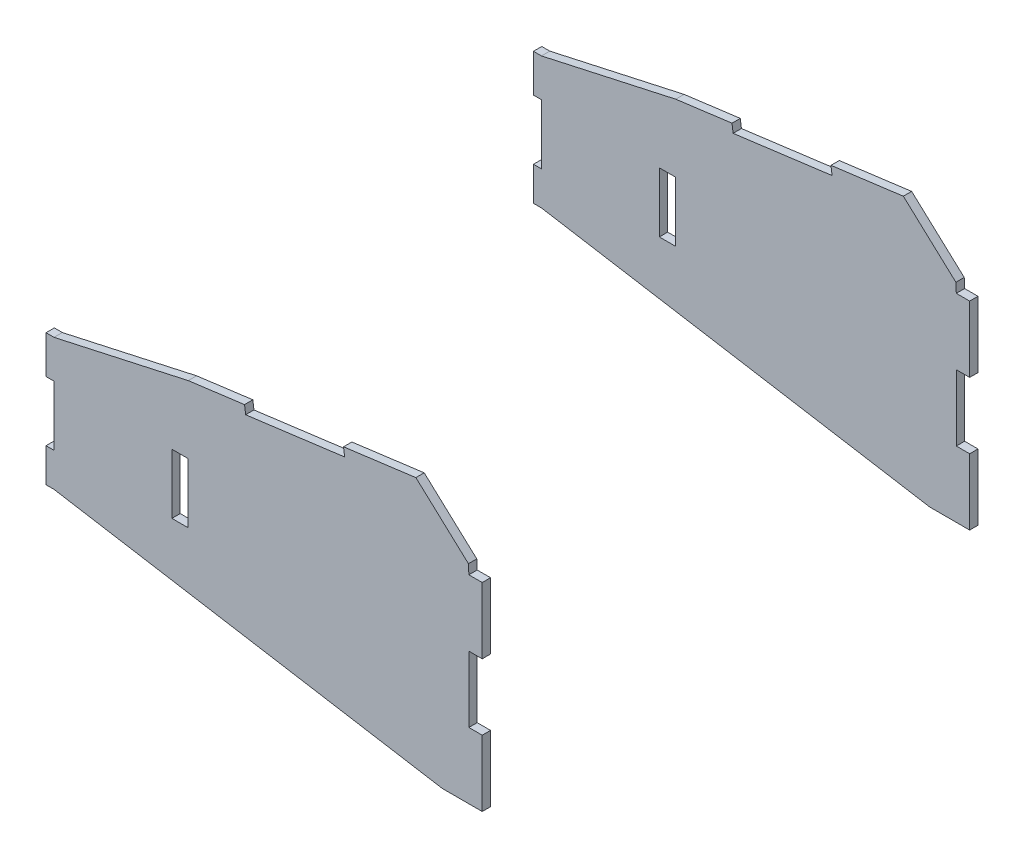
from build123d import *

# Parameters (mm, degrees)
BOSS_EXTRUDE6_START = 304.8
SKETCH1_W           = 20.828
SKETCH1_H           = 76.2
BOSS_EXTRUDE6_DEPTH = 10.6
BOSS_EXTRUDE7_START = -315.4
SKETCH1_6_W         = 20.828
SKETCH1_6_H         = 76.2
BOSS_EXTRUDE7_DEPTH = 10.6


with BuildPart() as part:
    # Sketch1 → Boss-Extrude6 (new body)
    with BuildSketch(Plane.XY.offset(BOSS_EXTRUDE6_START)):
        Polygon((-0.51423671, -82.284564229), (-67.405254048, -20.89578312), (-159.464400403, -32.943769451), (-158.088884295, -43.454143157), (-284.015059826, -59.934383324), (-285.390575935, -49.424009618), (-357.019247807, -58.79821407), (-527.847247807, -96.532420332), (-538.007247807, -96.532420332), (-538.007247807, -144.81700053), (-527.847247807, -144.81700053), (-527.847247807, -221.01700053), (-538.007247807, -221.01700053), (-538.007247807, -264.076781879), (-527.847247807, -264.076781879), (-33.8, -346.614163433), (17, -346.614163433), (17, -262.500622574), (0, -262.500622574), (0, -178.387081716), (17, -178.387081716), (17, -94.273540858), (0, -94.273540858), align=None)
        with Locations((-367.433247807, -182.91700053)):
            Rectangle(SKETCH1_W, SKETCH1_H, mode=Mode.SUBTRACT)
    extrude(amount=BOSS_EXTRUDE6_DEPTH)


with BuildPart() as body_2:
    # Sketch1<6> → Boss-Extrude7 (new body)
    with BuildSketch(Plane.XY.offset(BOSS_EXTRUDE7_START)):
        Polygon((-0.51423671, -82.284564229), (-67.405254048, -20.89578312), (-159.464400403, -32.943769451), (-158.088884295, -43.454143157), (-284.015059826, -59.934383324), (-285.390575935, -49.424009618), (-357.019247807, -58.79821407), (-527.847247807, -96.532420332), (-538.007247807, -96.532420332), (-538.007247807, -144.81700053), (-527.847247807, -144.81700053), (-527.847247807, -221.01700053), (-538.007247807, -221.01700053), (-538.007247807, -264.076781879), (-527.847247807, -264.076781879), (-33.8, -346.614163433), (17, -346.614163433), (17, -262.500622574), (0, -262.500622574), (0, -178.387081716), (17, -178.387081716), (17, -94.273540858), (0, -94.273540858), align=None)
        with Locations((-367.433247807, -182.91700053)):
            Rectangle(SKETCH1_6_W, SKETCH1_6_H, mode=Mode.SUBTRACT)
    extrude(amount=BOSS_EXTRUDE7_DEPTH)


solid = Compound([part.part, body_2.part])
